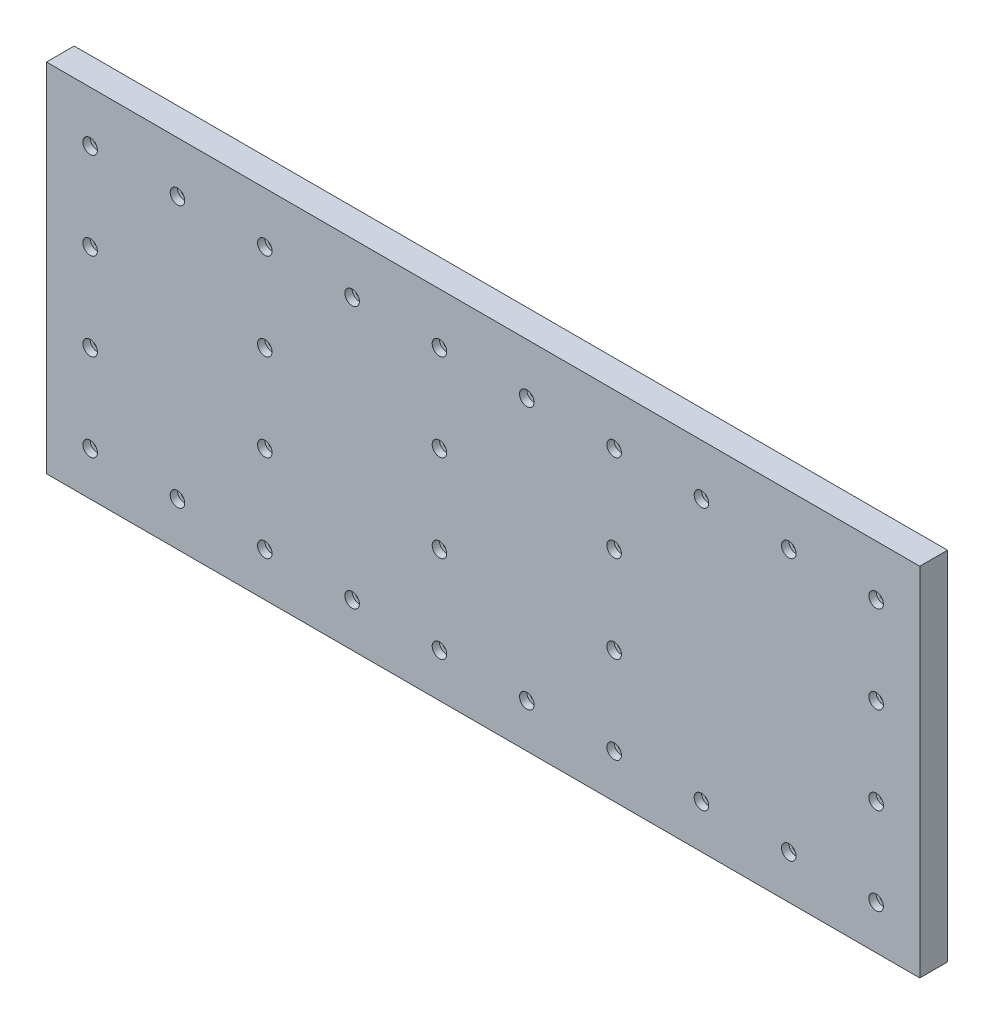
from build123d import *

# Parameters (mm, degrees)
SKETCH1_W                      = 600
SKETCH1_H                      = 245
BOSS_EXTRUDE1_DEPTH            = 19.05
CBORE_FOR_M5_SHCS1_D           = 5
CBORE_FOR_M5_SHCS1_DEPTH       = 28.497848452
CBORE_FOR_M5_SHCS1_CBORE_D     = 10
CBORE_FOR_M5_SHCS1_CBORE_DEPTH = 5
CBORE_FOR_M5_SHCS1_TIP         = 1.502151548


with BuildPart() as part:
    # Sketch1 → Boss-Extrude1 (new body)
    with BuildSketch(Plane.XY):
        with Locations((0, 127.5)):
            Rectangle(SKETCH1_W, SKETCH1_H)
    extrude(amount=BOSS_EXTRUDE1_DEPTH)

    # CBORE for M5 SHCS1
    with Locations(Plane.XY.offset(19.05)):
        with Locations((-270, 215), (-210, 215), (-150, 215), (-90, 215), (-30, 215), (30, 215), (90, 215), (150, 215), (210, 215), (270, 215), (270, 155), (270, 95), (90, 155), (90, 95), (-30, 155), (-30, 95), (-150, 155), (-270, 155), (-270, 95), (-150, 95), (-270, 35), (-210, 35), (-150, 35), (-90, 35), (-30, 35), (30, 35), (90, 35), (150, 35), (210, 35), (270, 35)):
            CounterBoreHole(CBORE_FOR_M5_SHCS1_D / 2, CBORE_FOR_M5_SHCS1_CBORE_D / 2, CBORE_FOR_M5_SHCS1_CBORE_DEPTH, depth=CBORE_FOR_M5_SHCS1_DEPTH)
            with Locations((0, 0, -(CBORE_FOR_M5_SHCS1_DEPTH + CBORE_FOR_M5_SHCS1_TIP / 2))):  # 118° drill point
                Cone(0, CBORE_FOR_M5_SHCS1_D / 2, CBORE_FOR_M5_SHCS1_TIP, mode=Mode.SUBTRACT)


solid = part.part
